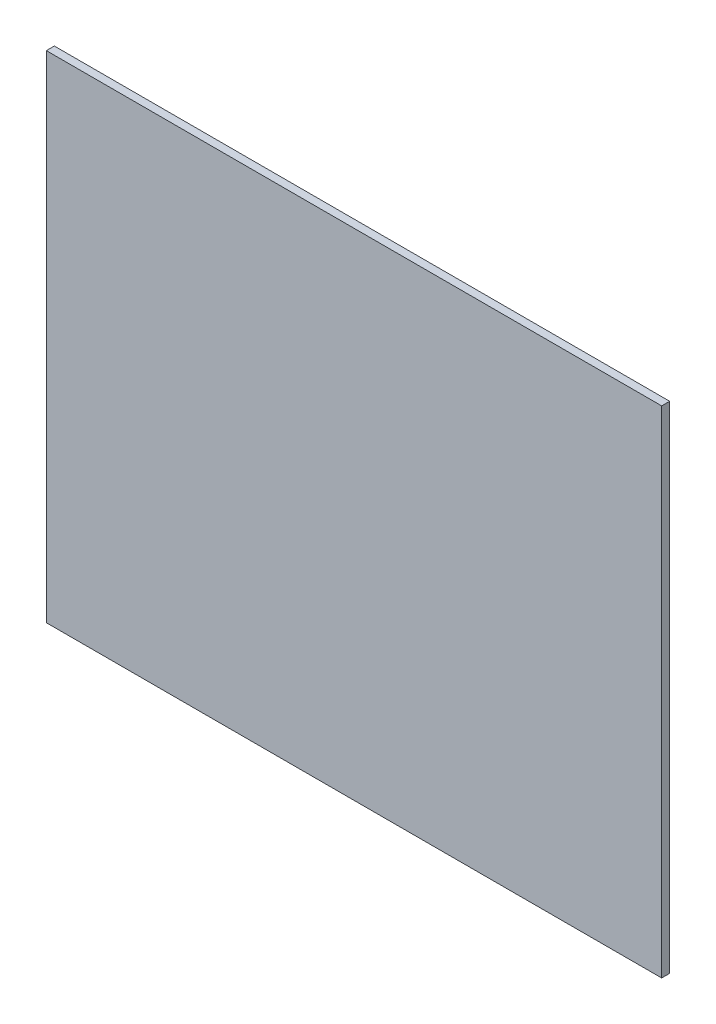
from build123d import *

# Parameters (mm, degrees)
SKETCH1_W           = 154
SKETCH1_H           = 124
BOSS_EXTRUDE1_DEPTH = 2


with BuildPart() as part:
    # Sketch1 → Boss-Extrude1 (new body)
    with BuildSketch(Plane.XY):
        with Locations((77, -62)):
            Rectangle(SKETCH1_W, SKETCH1_H)
    extrude(amount=BOSS_EXTRUDE1_DEPTH)


solid = part.part
